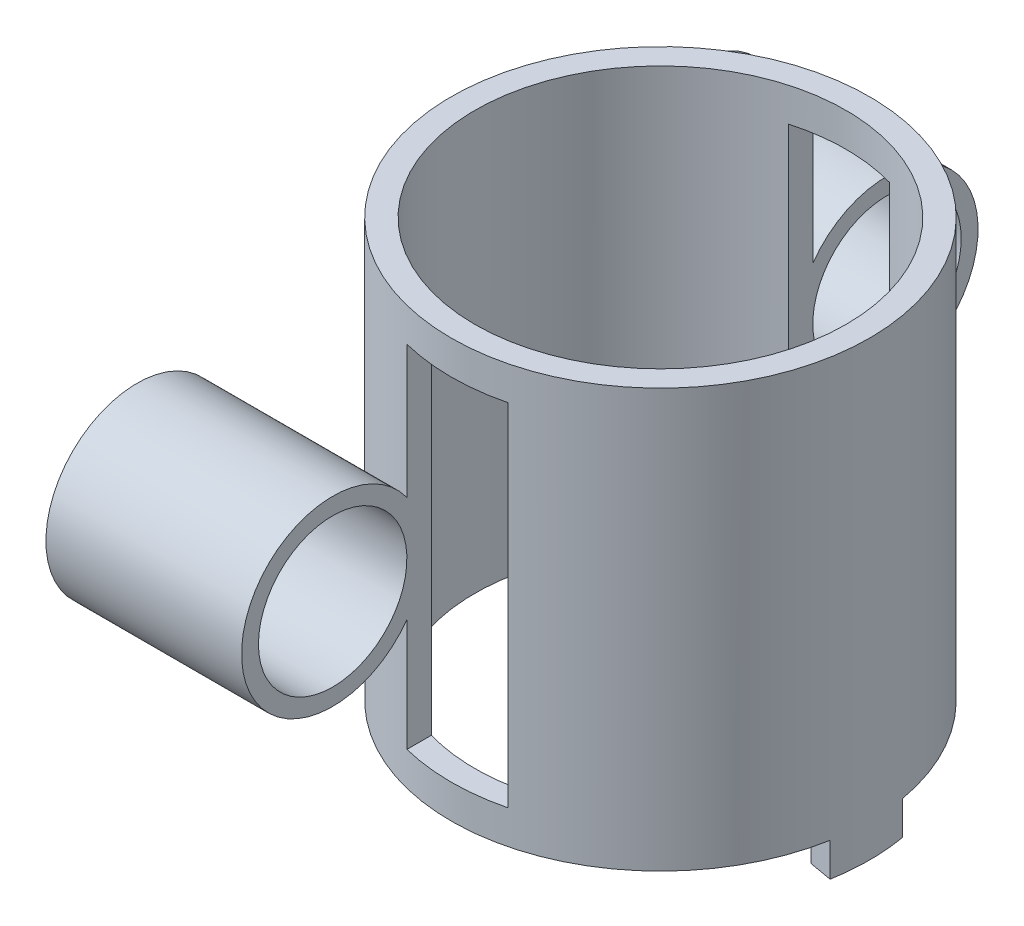
from build123d import *
from build123d.topology import SkipClean

# Parameters (mm, degrees)
SKETCH1_R               = 31
SKETCH1_R_2             = 27.5
BOSS_EXTRUDE1_DEPTH     = 62
BOSS_EXTRUDE3_START     = 5
BOSS_EXTRUDE3_DEPTH     = 5
CUT_EXTRUDE1_DEPTH      = 76.934182026
CUT_EXTRUDE1_DEPTH_BACK = 76.934182026
SKETCH8_W               = 15
SKETCH8_H               = 52
SKETCH9_R               = 13.5
SKETCH9_R_2             = 11
BOSS_EXTRUDE4_DEPTH     = 26
SKETCH10_R              = 13.5
BOSS_EXTRUDE5_DEPTH     = 3
SKETCH12_R              = 1.5
CUT_EXTRUDE2_DEPTH      = 3


with BuildPart() as part:
    # Sketch1 → Boss-Extrude1 (new body)
    with BuildSketch(Plane(origin=(0, 0, 0), x_dir=(1, 0, 0), z_dir=(0, 1, 0))):
        with Locations(Location((0, 0, 0), (0, 0, 270))):
            Circle(SKETCH1_R)
        with Locations(Location((0, 0, 0), (0, 0, 270))):
            Circle(SKETCH1_R_2, mode=Mode.SUBTRACT)
    extrude(amount=BOSS_EXTRUDE1_DEPTH)

    # Sketch6 → Boss-Extrude3 (add)
    with SkipClean():  # the faces are left unmerged after this step: merging them gives an invalid solid
        with BuildSketch(Plane.XZ.offset(BOSS_EXTRUDE3_START)):
            with BuildLine():
                Line((31, 0), (27.5, 0))
                ThreePointArc((27.5, 0), (27.395354198, -2.396782926), (27.082213208, -4.775324886))
                Line((27.082213208, -4.775324886), (30.529040343, -5.383093508))
                ThreePointArc((30.529040343, -5.383093508), (30.882035641, -2.701828025), (31, 0))
            make_face()
            with BuildLine():
                ThreePointArc((27.082213208, 4.775324886), (27.395354198, 2.396782926), (27.5, 0))
                Line((27.5, 0), (31, 0))
                ThreePointArc((31, 0), (30.882035641, 2.701828025), (30.529040343, 5.383093508))
                Line((30.529040343, 5.383093508), (27.082213208, 4.775324886))
            make_face()
        extrude(amount=-BOSS_EXTRUDE3_DEPTH)

    # Sketch8 → Cut-Extrude1 (cut, two sides: drawn at the far end of the back side and taken through both)
    with BuildSketch(Plane.XY.offset(-CUT_EXTRUDE1_DEPTH_BACK)):
        with Locations((0, 31)):
            Rectangle(SKETCH8_W, SKETCH8_H)
    extrude(amount=CUT_EXTRUDE1_DEPTH + CUT_EXTRUDE1_DEPTH_BACK, mode=Mode.SUBTRACT)

    # Sketch9 → Boss-Extrude4 (add)
    with BuildSketch(Plane(origin=(-7.5, 0, 0), x_dir=(0, 0, -1), z_dir=(1, 0, 0))):
        with Locations(Location((41.079062485, 29.5, 0), (0, 0, 270))):
            Circle(SKETCH9_R)
        with Locations((41.079062485, 29.5)):
            Circle(SKETCH9_R_2, mode=Mode.SUBTRACT)
    boss_extrude4 = extrude(amount=-BOSS_EXTRUDE4_DEPTH)

    # Sketch10 → Boss-Extrude5 (add)
    with BuildSketch(Plane.ZY.offset(33.5)):
        with Locations(Location((-41.079062485, 29.5, 0), (0, 0, 270))):
            Circle(SKETCH10_R)
    boss_extrude5 = extrude(amount=BOSS_EXTRUDE5_DEPTH)

    # Sketch12 → Cut-Extrude2 (cut)
    with BuildSketch(Plane(origin=(-17.285590039, -28.448353543, -28.838033475), x_dir=(1, 0, 0), z_dir=(0, 0, 1))):
        with Locations((-14.214409961, 57.948353543)):
            Circle(SKETCH12_R)
    cut_extrude2 = extrude(amount=-CUT_EXTRUDE2_DEPTH, mode=Mode.SUBTRACT)

    # Mirror1: Boss-Extrude4, Boss-Extrude5, Cut-Extrude2 across plane
    add(boss_extrude4.mirror(Plane.XY))
    add(boss_extrude5.mirror(Plane.XY))
    add(cut_extrude2.mirror(Plane.XY), mode=Mode.SUBTRACT)


solid = part.part
